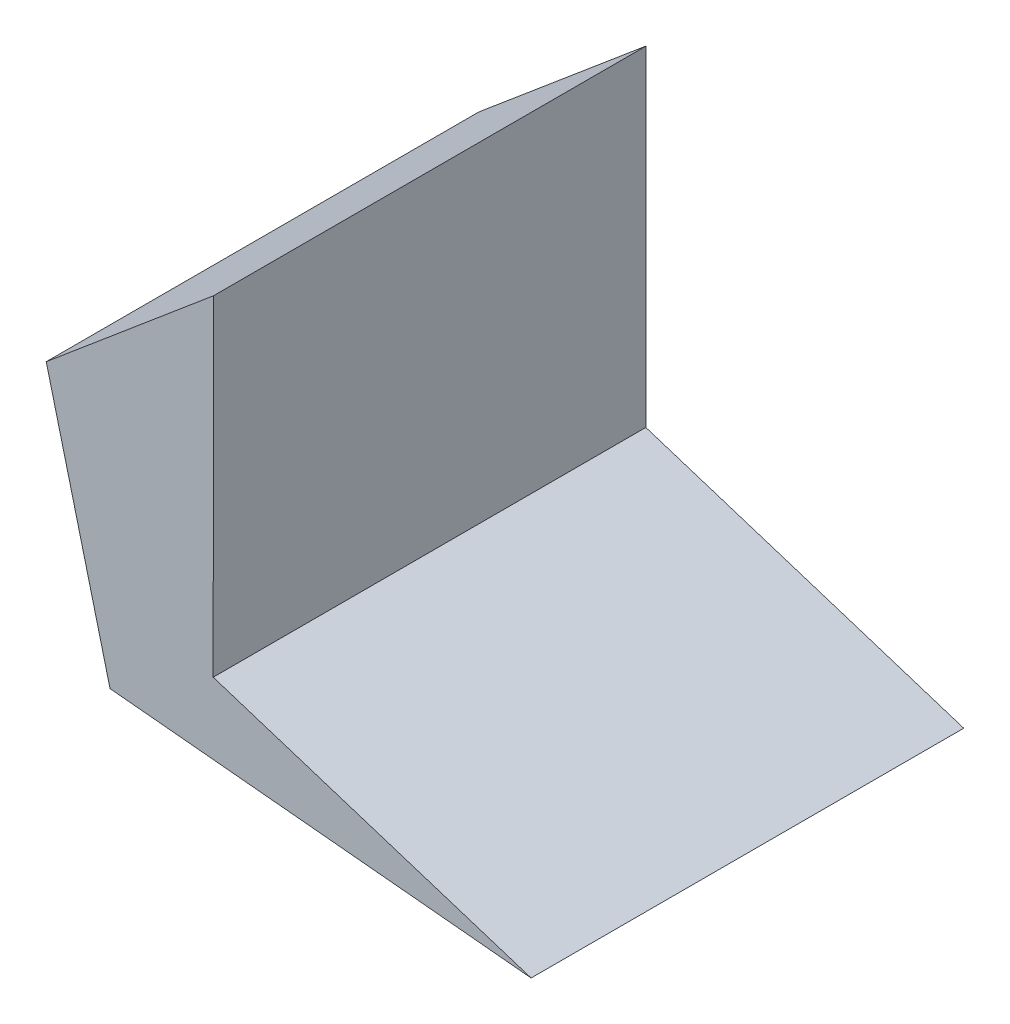
from build123d import *

# Parameters (mm, degrees)
BOSS_EXTRUDE1_DEPTH = 15.5


with BuildPart() as part:
    # Sketch1 → Boss-Extrude1 (new body)
    with BuildSketch(Plane.XY):
        Polygon((-158.172150747, -49.796885596), (-173.257797228, -48.360987916), (-175.543179908, -39.360912931), (-169.552568547, -34.320764913), (-169.562304459, -46.160309931), align=None)
    extrude(amount=BOSS_EXTRUDE1_DEPTH)


solid = part.part
